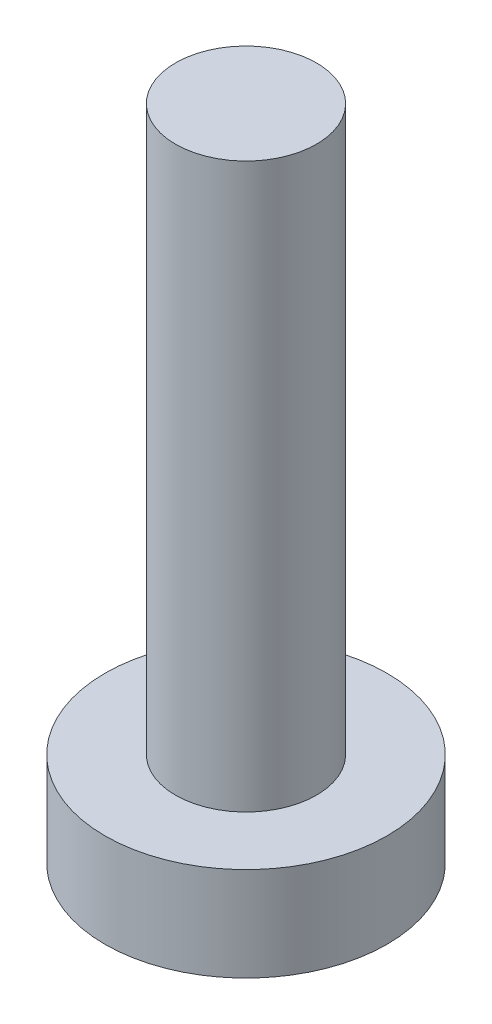
from build123d import *

# Parameters (mm, degrees)
SKETCH2_R           = 3
BOSS_EXTRUDE1_DEPTH = 2
SKETCH3_R           = 1.5
BOSS_EXTRUDE2_DEPTH = 12


with BuildPart() as part:
    # Sketch2 → Boss-Extrude1 (new body)
    with BuildSketch(Plane(origin=(0, 0, 0), x_dir=(1, 0, 0), z_dir=(0, 1, 0))):
        with Locations(Location((0, 0, 0), (0, 0, 270))):
            Circle(SKETCH2_R)
    extrude(amount=BOSS_EXTRUDE1_DEPTH)

    # Sketch3 → Boss-Extrude2 (add)
    with BuildSketch(Plane(origin=(0, 2, 0), x_dir=(1, 0, 0), z_dir=(0, 1, 0))):
        with Locations(Location((0, 0, 0), (0, 0, 270))):
            Circle(SKETCH3_R)
    extrude(amount=BOSS_EXTRUDE2_DEPTH)


solid = part.part
